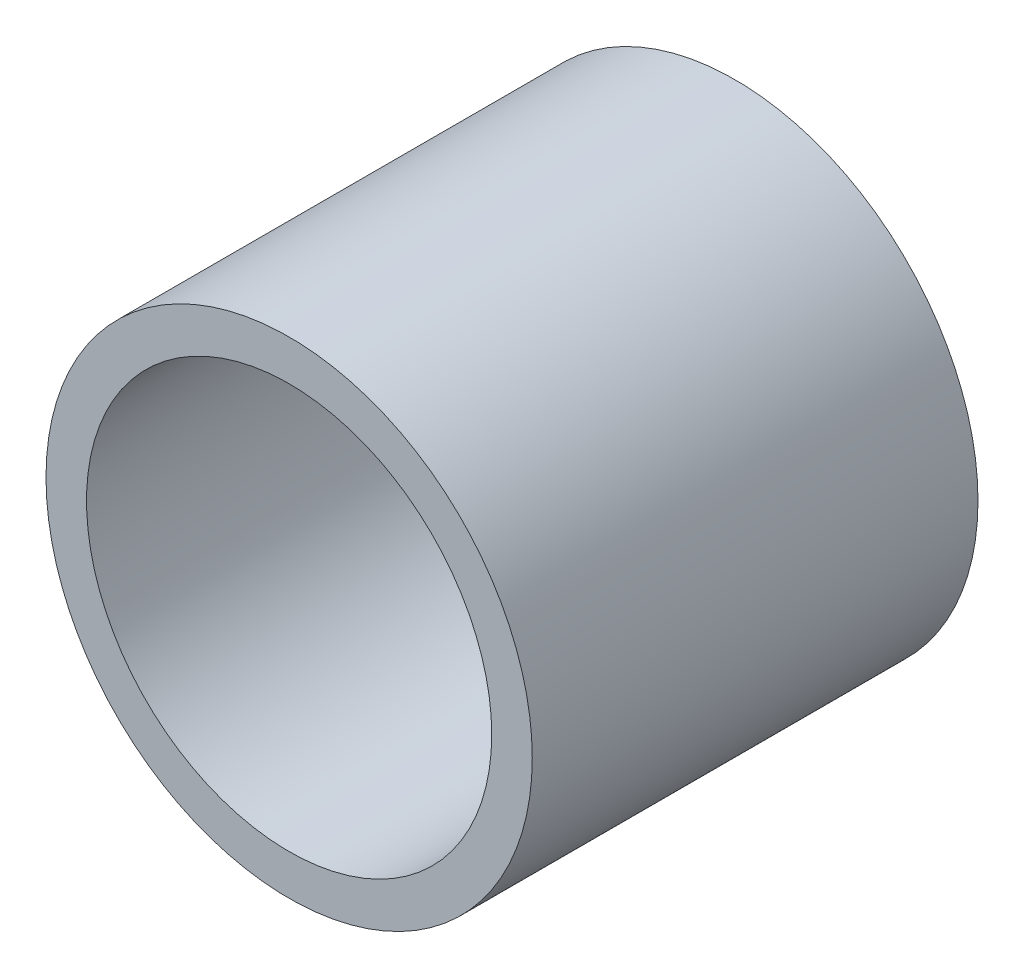
from build123d import *

# Parameters (mm, degrees)
SKETCH_1_R      = 6
SKETCH_1_R_2    = 5
EXTRUDE_1_DEPTH = 11


with BuildPart() as part:
    # 草图1 → 凸台-拉伸1 (new body)
    with BuildSketch(Plane.XY):
        Circle(SKETCH_1_R)
        Circle(SKETCH_1_R_2, mode=Mode.SUBTRACT)
    extrude(amount=EXTRUDE_1_DEPTH)


solid = part.part
